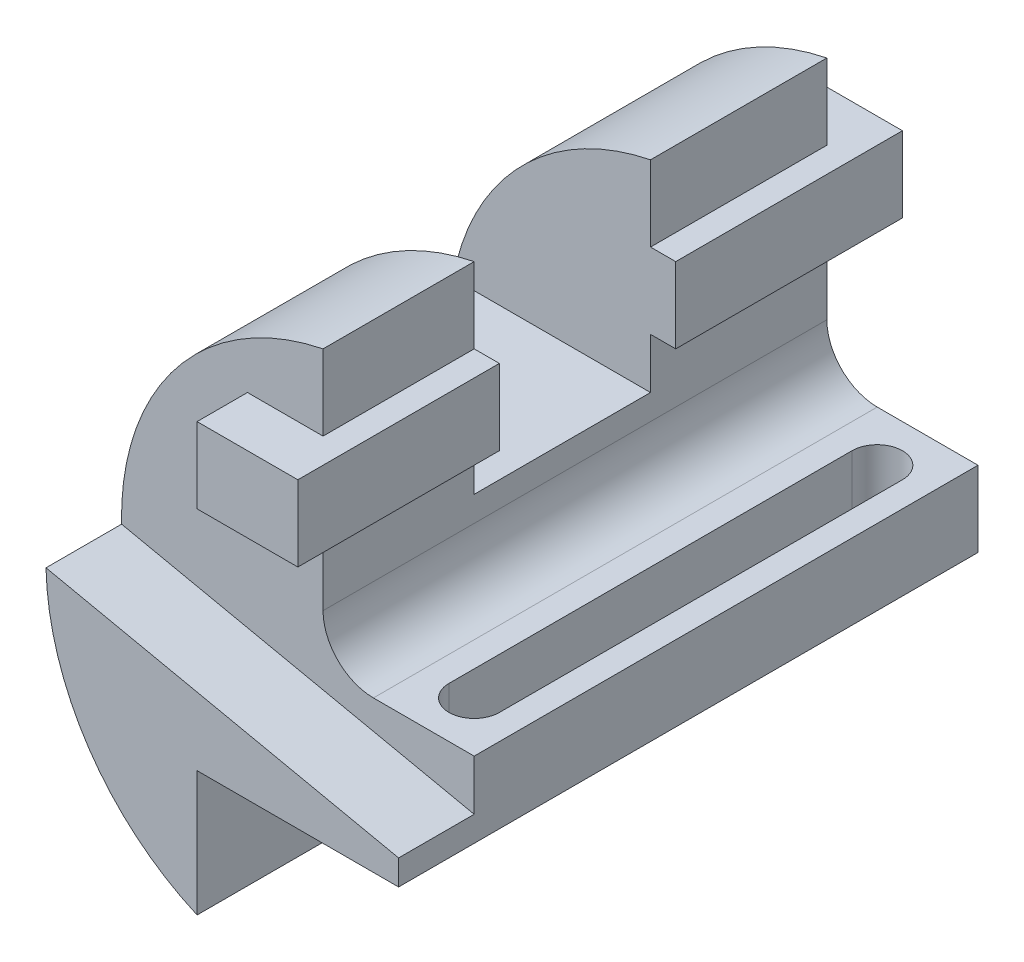
from build123d import *

# Parameters (mm, degrees)
BOSS_EXTRUDE1_DEPTH      = 115
CUT_EXTRUDE1_START       = -15
CUT_EXTRUDE1_DEPTH       = 15
BOSS_EXTRUDE2_DEPTH      = 10
BOSS_EXTRUDE2_DEPTH_BACK = 110
SKETCH3_W                = 20
SKETCH3_H                = 15
CUT_EXTRUDE2_DEPTH       = 141.445719052
CUT_EXTRUDE2_DEPTH_BACK  = 141.445719052
SKETCH4_W                = 35
SKETCH4_H                = 40
CUT_EXTRUDE3_DEPTH       = 146.430395722
CUT_EXTRUDE3_DEPTH_BACK  = 146.430395722


with BuildPart() as part:
    # Sketch1 → Boss-Extrude1 (new body)
    with BuildSketch(Plane.XY):
        with BuildLine():
            Line((0, 0), (-40, 0))
            Line((-40, 0), (-40, -24.815551805))
            ThreePointArc((-40, -24.815551805), (-69.724211568, 26.254514819), (-30, 70))
            Line((-30, 70), (-30, 25))
            ThreePointArc((-30, 25), (-27.071067812, 17.928932188), (-20, 15))
            Line((-20, 15), (0, 15))
            Line((0, 15), (0, 0))
        make_face()
    extrude(amount=BOSS_EXTRUDE1_DEPTH)

    # Sketch2 → Cut-Extrude1 (cut)
    with BuildSketch(Plane.XY.offset(115).offset(CUT_EXTRUDE1_START)):
        with BuildLine():
            Line((0, 5), (-69.987139252, 19.87622568))
            ThreePointArc((-69.987139252, 19.87622568), (-59.085961763, 52.191731616), (-30, 70))
            Line((-30, 70), (-30, 25))
            ThreePointArc((-30, 25), (-27.071067812, 17.928932188), (-20, 15))
            Line((-20, 15), (0, 15))
            Line((0, 15), (0, 5))
        make_face()
    extrude(amount=CUT_EXTRUDE1_DEPTH, mode=Mode.SUBTRACT)

    # Sketch3 → Boss-Extrude2 (add, two sides: drawn at the far end of the back side and taken through both)
    with BuildSketch(Plane(origin=(0, 0, 0), x_dir=(-1, 0, 0), z_dir=(0, 0, -1)).offset(-BOSS_EXTRUDE2_DEPTH_BACK)):
        with Locations((35, 47.5)):
            Rectangle(SKETCH3_W, SKETCH3_H)
    extrude(amount=BOSS_EXTRUDE2_DEPTH + BOSS_EXTRUDE2_DEPTH_BACK)

    # Sketch4 → Cut-Extrude2 (cut, two sides: drawn at the far end of the back side and taken through both)
    with BuildSketch(Plane(origin=(-30, 0, 0), x_dir=(0, 0, -1), z_dir=(1, 0, 0)).offset(-CUT_EXTRUDE2_DEPTH_BACK)):
        with Locations((-52.5, 50)):
            Rectangle(SKETCH4_W, SKETCH4_H)
    extrude(amount=CUT_EXTRUDE2_DEPTH + CUT_EXTRUDE2_DEPTH_BACK, mode=Mode.SUBTRACT)

    # Sketch5 → Cut-Extrude3 (cut, two sides: drawn at the far end of the back side and taken through both)
    with BuildSketch(Plane(origin=(0, 15, 0), x_dir=(1, 0, 0), z_dir=(0, 1, 0)).offset(-CUT_EXTRUDE3_DEPTH_BACK)):
        with BuildLine():
            Line((-5, -10), (-5, -90))
            ThreePointArc((-5, -90), (-10, -95), (-15, -90))
            Line((-15, -90), (-15, -10))
            ThreePointArc((-15, -10), (-10, -5), (-5, -10))
        make_face()
    extrude(amount=CUT_EXTRUDE3_DEPTH + CUT_EXTRUDE3_DEPTH_BACK, mode=Mode.SUBTRACT)


solid = part.part
